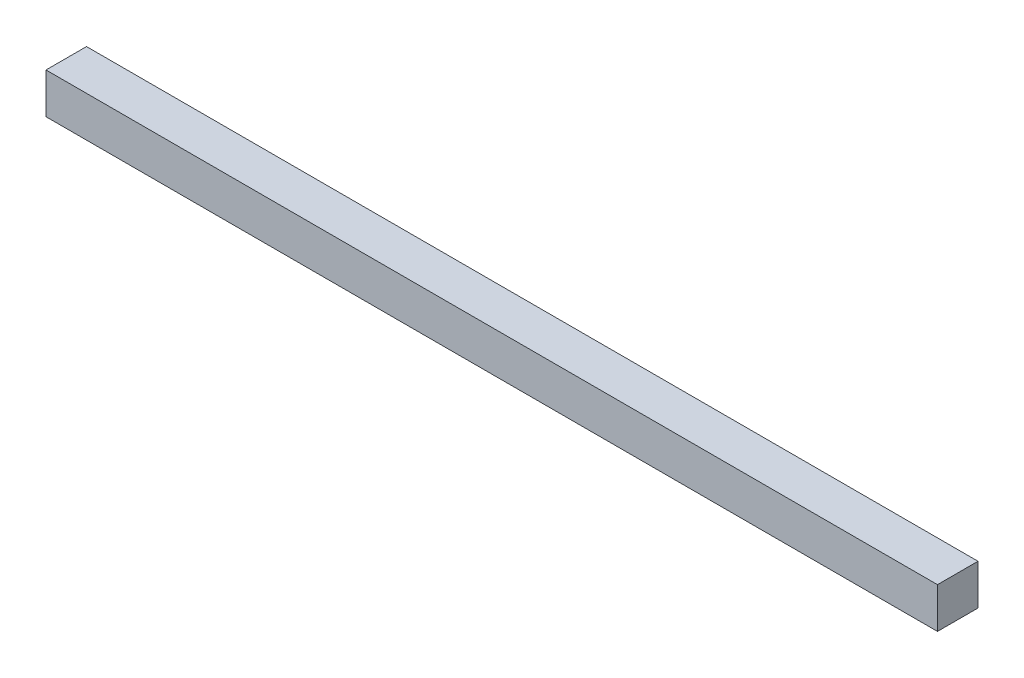
from build123d import *

# Parameters (mm, degrees)
SKETCH1_W           = 50.8
SKETCH1_H           = 50.8
BOSS_EXTRUDE1_DEPTH = 1117.6


with BuildPart() as part:
    # Sketch1 → Boss-Extrude1 (new body)
    with BuildSketch(Plane(origin=(0, 0, 0), x_dir=(0, 0, -1), z_dir=(1, 0, 0))):
        Rectangle(SKETCH1_W, SKETCH1_H)
    extrude(amount=BOSS_EXTRUDE1_DEPTH)


solid = part.part
